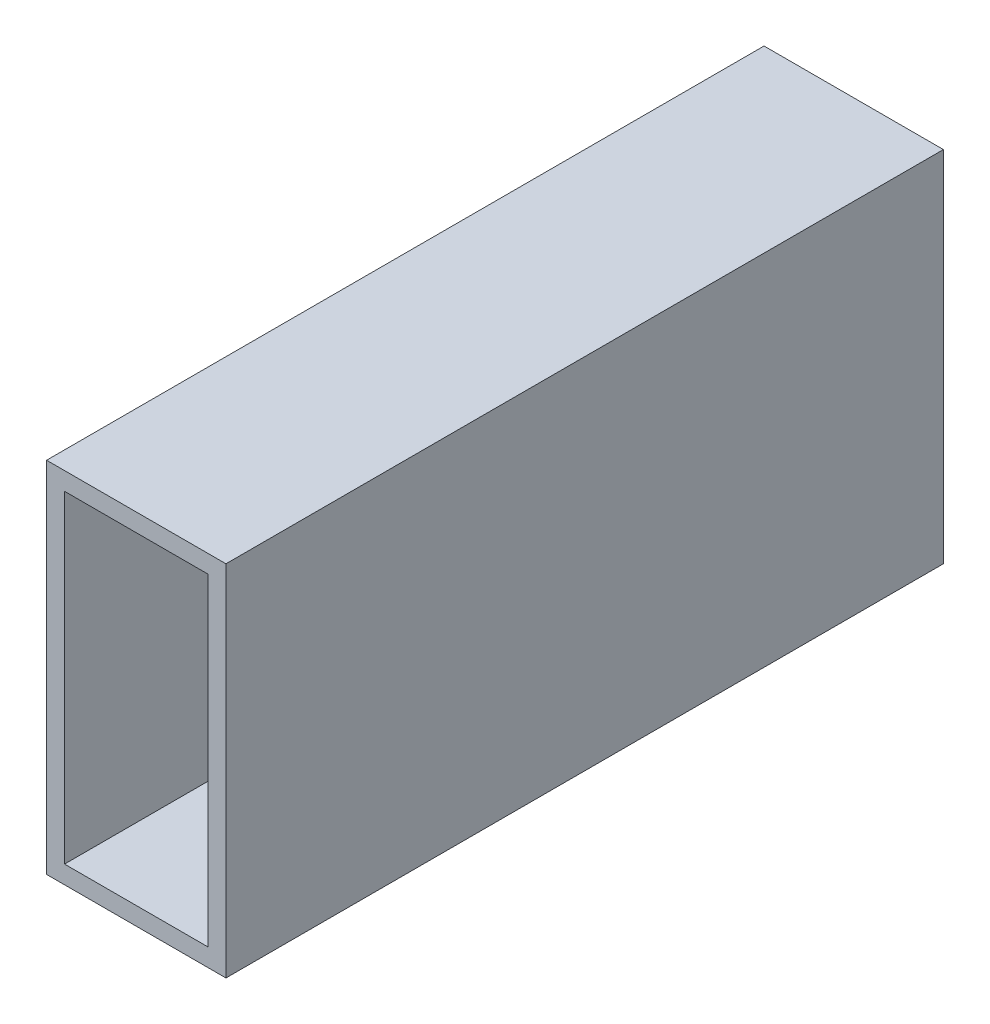
from build123d import *

# Parameters (mm, degrees)
SKETCH1_W           = 10
SKETCH1_H           = 20
SKETCH1_W_2         = 8
SKETCH1_H_2         = 18
BOSS_EXTRUDE1_DEPTH = 40


with BuildPart() as part:
    # Sketch1 → Boss-Extrude1 (new body)
    with BuildSketch(Plane.XY):
        Rectangle(SKETCH1_W, SKETCH1_H)
        Rectangle(SKETCH1_W_2, SKETCH1_H_2, mode=Mode.SUBTRACT)
    extrude(amount=BOSS_EXTRUDE1_DEPTH)


solid = part.part
